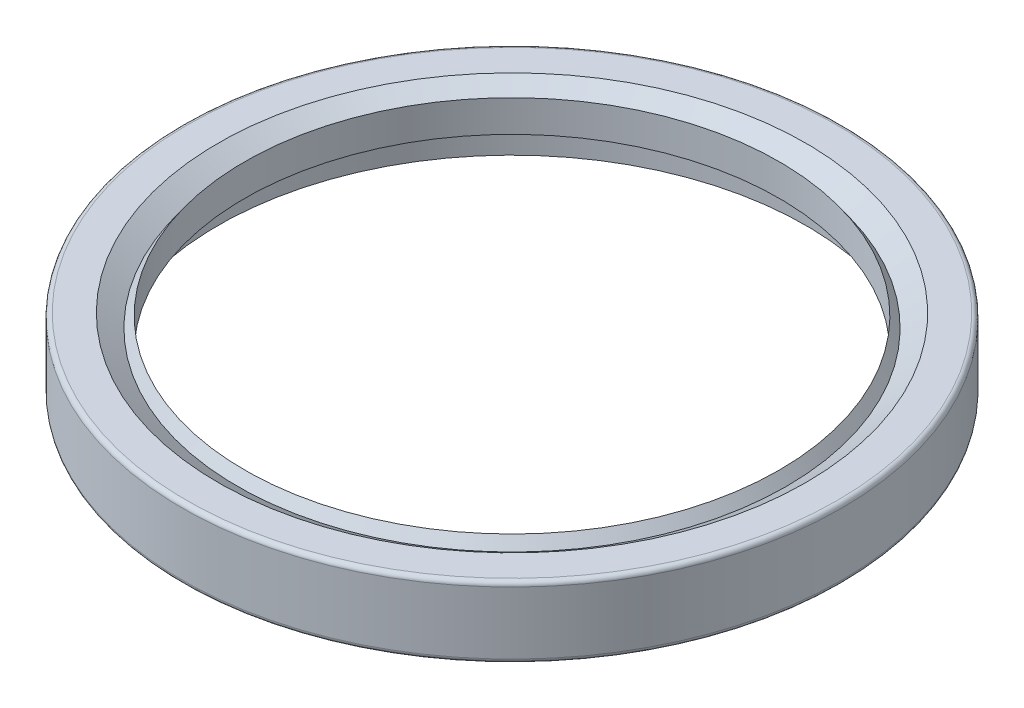
from build123d import *


with BuildPart() as part:
    # Schizzo1 → Rivoluzione1 (revolve)
    with BuildSketch(Plane.XY, mode=Mode.PRIVATE) as rivoluzione1_sk:
        with BuildLine():
            Line((-33, 0), (-36.5, 0))
            ThreePointArc((-36.5, 0), (-36.853553391, 0.146446609), (-37, 0.5))
            Line((-37, 0.5), (-37, 7.5))
            ThreePointArc((-37, 7.5), (-36.853553391, 7.853553391), (-36.5, 8))
            Line((-36.5, 8), (-33, 8))
            Line((-33, 8), (-30.814092893, 6.534380349))
            Line((-30.814092893, 6.534380349), (-30, 7.707960129))
            Line((-30, 7.707960129), (-30, 6.133062593))
            Line((-30, 6.133062593), (-30, 4.144217363))
            Line((-30, 4.144217363), (-33, 6.155674729))
            Line((-33, 6.155674729), (-33, 0))
        make_face()
    revolve(rivoluzione1_sk.sketch.rotate(Axis((0, 0, 0), (0, 1, 0)), 180), axis=Axis((0, 0, 0), (0, 1, 0)))


solid = part.part
